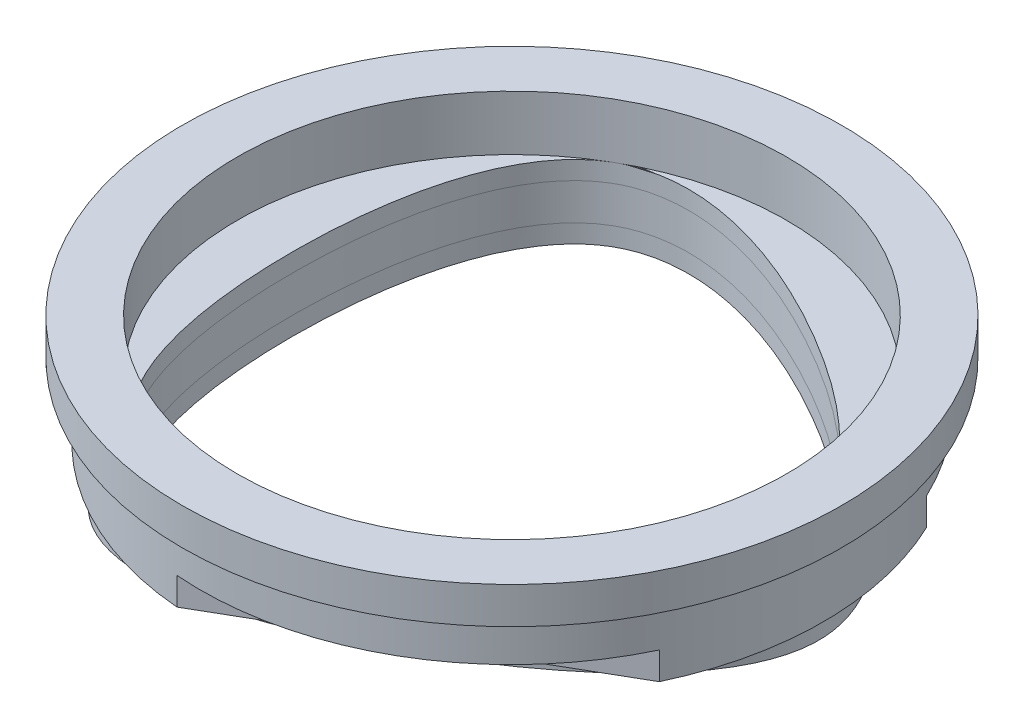
from build123d import *
from build123d.topology import SkipClean

# Parameters (mm, degrees)
EXTRUDE_1_DEPTH     = 10
EXTRUDE_2_DEPTH     = 20
SKETCH_6_R          = 170
EXTRUDE_3_DEPTH     = 20
SKETCH_7_R          = 180
SKETCH_7_R_2        = 150
EXTRUDE_4_DEPTH     = 20
EXTRUDE_START       = 5
EXTRUDE_5_DEPTH     = 5
CUT_EXTRUDE_START   = -10
SKETCH_9_R          = 150
CUT_EXTRUDE_1_DEPTH = 10


with BuildPart() as part:
    # 草图2 → 凸台-拉伸1 (new body)
    with BuildSketch(Plane(origin=(0, 0, 0), x_dir=(1, 0, 0), z_dir=(0, 1, 0))):
        with BuildLine():
            add(Edge.make_bspline(
                [(66.25, 114.748366001), (120, 83.715789032), (215, 0), (72.5, -125.573683549), (-107.5, -186.195461814), (-145, 0), (-107.5, 186.195461814), (12.5, 145.78094297), (66.25, 114.748366001)],
                knots=[0, 0, 0, 0, 0.166666667, 0.333333333, 0.5, 0.666666667, 0.833333333, 1, 1, 1, 1], degree=3))
        make_face()
        with BuildLine():
            add(Edge.make_bspline(
                [(60, 103.923048454), (108, 76.210235533), (192, 0), (66, -114.3153533), (-96, -166.276877527), (-132, 0), (-96, 166.276877527), (12, 131.635861375), (60, 103.923048454)],
                knots=[0, 0, 0, 0, 0.166666667, 0.333333333, 0.5, 0.666666667, 0.833333333, 1, 1, 1, 1], degree=3))
        make_face(mode=Mode.SUBTRACT)
    extrude(amount=-EXTRUDE_1_DEPTH)

    # 草图3 → 凸台-拉伸2 (add)
    with BuildSketch(Plane(origin=(0, 0, 0), x_dir=(1, 0, 0), z_dir=(0, 1, 0))):
        with BuildLine():
            Line((-13.516465442, 169.461810335), (153.516465442, 73.025302725))
            ThreePointArc((153.516465442, 73.025302725), (170, 0), (153.516465442, -73.025302725))
            Line((153.516465442, -73.025302725), (-13.516465442, -169.461810335))
            ThreePointArc((-13.516465442, -169.461810335), (-85, -147.224318643), (-140, -96.43650761))
            Line((-140, -96.43650761), (-140, 96.43650761))
            ThreePointArc((-140, 96.43650761), (-85, 147.224318643), (-13.516465442, 169.461810335))
        make_face()
        with BuildLine():
            add(Edge.make_bspline(
                [(-75, 129.903810568), (-42, 148.956369451), (66, 114.3153533), (192, 0), (66, -114.3153533), (-96, -166.276877527), (-132, 0), (-108, 110.851251684), (-75, 129.903810568)],
                knots=[0, 0, 0, 0, 0.166666667, 0.333333333, 0.5, 0.666666667, 0.833333333, 1, 1, 1, 1], degree=3))
        make_face(mode=Mode.SUBTRACT)
    extrude(amount=EXTRUDE_2_DEPTH)

    # 草图6 → 凸台-拉伸3 (add)
    with BuildSketch(Plane(origin=(0, 20, 0), x_dir=(1, 0, 0), z_dir=(0, 1, 0))):
        with Locations(Location((0, 0, 0), (0, 0, 94.56032178))):
            Circle(SKETCH_6_R)
        with BuildLine():
            add(Edge.make_bspline(
                [(-75, -129.903810568), (-42, -148.956369451), (66, -114.3153533), (192, 0), (66, 114.3153533), (-96, 166.276877527), (-132, 0), (-108, -110.851251684), (-75, -129.903810568)],
                knots=[0, 0, 0, 0, 0.166666667, 0.333333333, 0.5, 0.666666667, 0.833333333, 1, 1, 1, 1], degree=3))
        make_face(mode=Mode.SUBTRACT)
    extrude(amount=EXTRUDE_3_DEPTH)

    # 草图7 → 凸台-拉伸4 (add)
    with BuildSketch(Plane(origin=(0, 40, 0), x_dir=(1, 0, 0), z_dir=(0, 1, 0))):
        with Locations(Location((0, 0, 0), (0, 0, 270))):
            Circle(SKETCH_7_R)
        with Locations(Location((0, 0, 0), (0, 0, 120))):
            Circle(SKETCH_7_R_2, mode=Mode.SUBTRACT)
    extrude(amount=EXTRUDE_4_DEPTH)

    # 草图8 → 凸台-拉伸5 (add)
    with SkipClean():  # the faces are left unmerged after this step: merging them gives an invalid solid
        with BuildSketch(Plane.XZ.offset(-20).offset(EXTRUDE_START)):
            with BuildLine():
                Line((-13.516465442, 169.461810335), (153.516465442, 73.025302725))
                ThreePointArc((153.516465442, 73.025302725), (85, 147.224318643), (-13.516465442, 169.461810335))
            make_face()
            with BuildLine():
                Line((-140, 96.43650761), (-140, -96.43650761))
                ThreePointArc((-140, -96.43650761), (-170, 0), (-140, 96.43650761))
            make_face()
            with BuildLine():
                Line((-13.516465442, -169.461810335), (153.516465442, -73.025302725))
                ThreePointArc((153.516465442, -73.025302725), (85, -147.224318643), (-13.516465442, -169.461810335))
            make_face()
        extrude(amount=-EXTRUDE_5_DEPTH)

    # 草图9 → 切除-拉伸1 (cut)
    with SkipClean():  # the faces are left unmerged after this step: merging them gives an invalid solid
        with BuildSketch(Plane(origin=(0, 40, 0), x_dir=(1, 0, 0), z_dir=(0, 1, 0)).offset(CUT_EXTRUDE_START)):
            with Locations(Location((0, 0, 0), (0, 0, 120))):
                Circle(SKETCH_9_R)
        extrude(amount=CUT_EXTRUDE_1_DEPTH, mode=Mode.SUBTRACT)


solid = part.part
